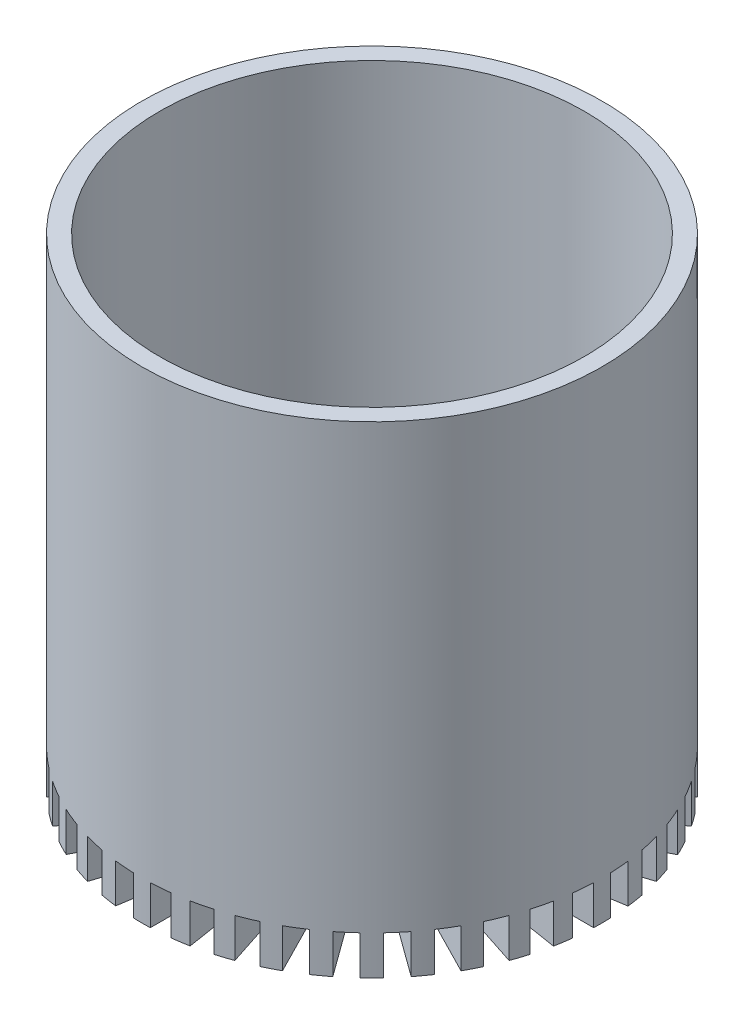
from build123d import *
from build123d.topology import SkipClean

# Parameters (mm, degrees)
SKETCH1_R               = 38.1
BOSS_EXTRUDE1_DEPTH     = 76.2
SHELL2_T                = 3.175
SKETCH2_W               = 3
SKETCH2_H               = 82.55
SKETCH2_W_2             = 82.55
SKETCH2_H_2             = 3
BOSS_EXTRUDE2_DEPTH     = 7
CUT_EXTRUDE1_DEPTH      = 99.527366122
CUT_EXTRUDE1_DEPTH_BACK = 99.527366122
SKETCH3_R               = 61.906276858
SKETCH3_R_2             = 41.275
SKETCH4_R               = 20.64
CUT_EXTRUDE2_DEPTH      = 7
SCALE1_SCALE            = 0.615384615


with BuildPart() as part:
    # Sketch1 → Boss-Extrude1 (new body)
    with BuildSketch(Plane(origin=(0, 0, 0), x_dir=(1, 0, 0), z_dir=(0, 1, 0))):
        with Locations(Location((0, 0, 0), (0, 0, 90))):
            Circle(SKETCH1_R)
    extrude(amount=BOSS_EXTRUDE1_DEPTH)

    # Shell2
    shell2_openings = [part.faces().sort_by_distance(p)[0] for p in [
        (0, 76.2, 0),
    ]]
    offset(amount=SHELL2_T, openings=shell2_openings, kind=Kind.INTERSECTION)

    # Sketch2 → Boss-Extrude2 (add)
    with BuildSketch(Plane(origin=(0, -3.175, 0), x_dir=(-1, 0, 0), z_dir=(0, -1, 0))):
        Rectangle(SKETCH2_W, SKETCH2_H)
        Polygon((-23.047310797, -34.273854321), (25.47436178, 32.510498564), (23.047310797, 34.273854321), (-25.47436178, -32.510498564), align=None)
        Polygon((-38.791332219, -14.181261217), (39.718383202, 11.328091668), (38.791332219, 14.181261217), (-39.718383202, -11.328091668), align=None)
        Polygon((-39.718383202, 11.328091668), (38.791332219, -14.181261217), (39.718383202, -11.328091668), (-38.791332219, 14.181261217), align=None)
        Polygon((-25.47436178, 32.510498564), (23.047310797, -34.273854321), (25.47436178, -32.510498564), (-23.047310797, 34.273854321), align=None)
        Polygon((-14.181261217, 38.791332218), (11.328091668, -39.718383202), (14.181261217, -38.791332219), (-11.328091668, 39.718383202), align=None)
        Polygon((11.328091668, 39.718383202), (-14.181261217, -38.791332219), (-11.328091668, -39.718383202), (14.181261217, 38.791332218), align=None)
        Polygon((32.510498564, 25.47436178), (-34.273854321, -23.047310797), (-32.510498564, -25.47436178), (34.273854321, 23.047310797), align=None)
        Rectangle(SKETCH2_W_2, SKETCH2_H_2)
        Polygon((-34.273854321, 23.047310797), (32.510498564, -25.47436178), (34.273854321, -23.047310797), (-32.510498564, 25.47436178), align=None)
        Polygon((-28.10354871, -30.266585121), (30.226384561, 28.146781368), (28.10354871, 30.266585121), (-30.226384561, -28.146781368), align=None)
        Polygon((-40.52650088, -7.967330255), (40.997921776, 5.004601388), (40.52650088, 7.967330255), (-40.997921776, -5.004601388), align=None)
        Polygon((-20.100758851, 36.080952296), (17.428713325, -37.44483378), (20.100758851, -36.080952296), (-17.428713325, 37.44483378), align=None)
        Polygon((-7.967330255, 40.52650088), (5.004601388, -40.997921776), (7.967330255, -40.52650088), (-5.004601389, 40.997921776), align=None)
        Polygon((17.375173968, 37.469707159), (-20.049166221, -36.109646341), (-17.375173968, -37.469707159), (20.049166221, 36.10964634), align=None)
        Polygon((-40.537847539, 7.909395801), (41.005033194, -4.945996138), (40.537847539, -7.909395801), (-41.005033194, 4.945996138), align=None)
        Polygon((37.469707159, -17.375173968), (-36.109646341, 20.049166221), (-37.469707159, 17.375173968), (36.10964634, -20.049166221), align=None)
        Polygon((7.909395801, 40.537847539), (-4.945996138, -41.005033194), (-7.909395801, -40.537847539), (4.945996138, 41.005033194), align=None)
        Polygon((-36.080952296, -20.100758851), (37.44483378, 17.428713325), (36.080952296, 20.100758852), (-37.44483378, -17.428713325), align=None)
        Polygon((30.266585121, -28.10354871), (-28.146781368, 30.226384561), (-30.266585121, 28.10354871), (28.146781368, -30.226384561), align=None)
    extrude(amount=BOSS_EXTRUDE2_DEPTH)

    # Sketch3 → Cut-Extrude1 (cut, two sides: drawn at the far end of the back side and taken through both)
    with SkipClean():  # the faces are left unmerged after this step: merging them gives an invalid solid
        with BuildSketch(Plane.XZ.offset(3.175).offset(-CUT_EXTRUDE1_DEPTH_BACK)):
            Circle(SKETCH3_R)
            with Locations(Location((0, 0, 0), (0, 0, 272.082679548))):
                Circle(SKETCH3_R_2, mode=Mode.SUBTRACT)
        extrude(amount=CUT_EXTRUDE1_DEPTH + CUT_EXTRUDE1_DEPTH_BACK, mode=Mode.SUBTRACT)

    # Sketch4 → Cut-Extrude2 (cut)
    with SkipClean():  # the faces are left unmerged after this step: merging them gives an invalid solid
        with BuildSketch(Plane.XZ.offset(10.175)):
            Circle(SKETCH4_R)
        extrude(amount=-CUT_EXTRUDE2_DEPTH, mode=Mode.SUBTRACT)


with BuildPart() as part_1:
    # Scale1: scaled about (-2.7e-08, 22.773644283, -1.5e-08)
    add(part.part.scale(SCALE1_SCALE).moved(Location((-1e-08, 8.759093955, -6e-09))))


solid = part_1.part
